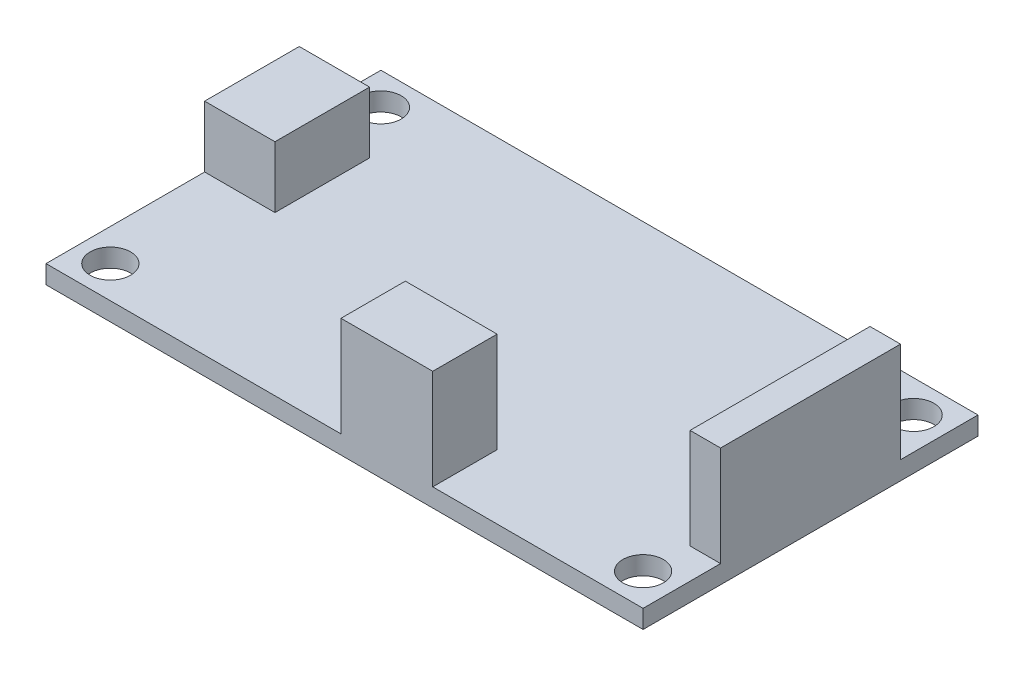
from build123d import *

# Parameters (mm, degrees)
SKETCH1_W      = 50.1
SKETCH1_H      = 28.1
SKETCH1_R      = 1.7
EXTRUDE1_DEPTH = 1.54
SKETCH2_W      = 2.56
SKETCH2_H      = 15.1
SKETCH2_W_2    = 7.7
SKETCH2_H_2    = 5.4
EXTRUDE3_DEPTH = 8.4
SKETCH3_W      = 5.9
SKETCH3_H      = 7.94
EXTRUDE4_DEPTH = 5.15


with BuildPart() as part:
    # Sketch1 → Extrude1 (new body)
    with BuildSketch(Plane(origin=(0, 0, 0), x_dir=(1, 0, 0), z_dir=(0, 1, 0))):
        with Locations((-74.07266419, 15.871623192)):
            Rectangle(SKETCH1_W, SKETCH1_H)
        with Locations(Location((-96.42266419, 27.221623192, 0), (0, 0, 270))):
            Circle(SKETCH1_R, mode=Mode.SUBTRACT)
        with Locations(Location((-51.72266419, 27.221623192, 0), (0, 0, 90))):
            Circle(SKETCH1_R, mode=Mode.SUBTRACT)
        with Locations(Location((-51.72266419, 4.521623192, 0), (0, 0, 270))):
            Circle(SKETCH1_R, mode=Mode.SUBTRACT)
        with Locations(Location((-96.42266419, 4.521623192, 0), (0, 0, 90))):
            Circle(SKETCH1_R, mode=Mode.SUBTRACT)
    extrude(amount=EXTRUDE1_DEPTH)

    # Sketch2 → Extrude3 (add)
    with BuildSketch(Plane(origin=(0, 1.54, 0), x_dir=(1, 0, 0), z_dir=(0, 1, 0))):
        with Locations((-50.30266419, 15.871623192)):
            Rectangle(SKETCH2_W, SKETCH2_H)
        with Locations((-70.52266419, 4.521623192)):
            Rectangle(SKETCH2_W_2, SKETCH2_H_2)
    extrude(amount=EXTRUDE3_DEPTH)

    # Sketch3 → Extrude4 (add)
    with BuildSketch(Plane(origin=(0, 1.54, 0), x_dir=(1, 0, 0), z_dir=(0, 1, 0))):
        with Locations((-96.17266419, 19.101623192)):
            Rectangle(SKETCH3_W, SKETCH3_H)
    extrude(amount=EXTRUDE4_DEPTH)


solid = part.part
